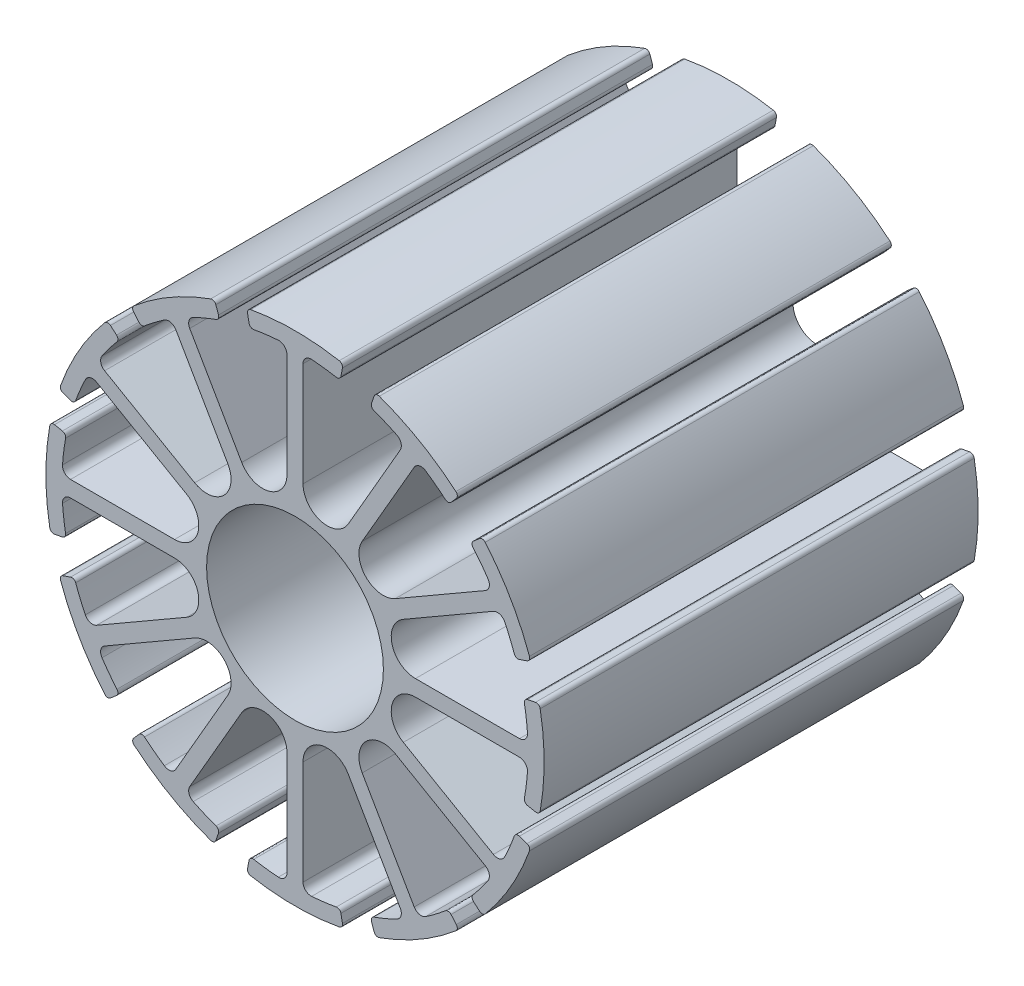
from build123d import *

# Parameters (mm, degrees)
ESBO_O1_R                = 5.5
RESSALTO_EXTRUS_O1_DEPTH = 13.5


with BuildPart() as part:
    # Esboço1 → Ressalto-extrusão1 (new, symmetric)
    with BuildSketch(Plane.XY):
        with BuildLine():
            ThreePointArc((-2.751223029, 15.253884947), (-2.913101633, 15.149133652), (-2.952292747, 14.960343895))
            Line((-2.952292747, 14.960343895), (-2.857263318, 14.469414654))
            ThreePointArc((-2.857263318, 14.469414654), (-2.753143031, 14.310703103), (-2.567551595, 14.270875852))
            ThreePointArc((-2.567551595, 14.270875852), (-1.804201607, 14.387322357), (-1.035735014, 14.462966838))
            ThreePointArc((-1.035735014, 14.462966838), (-0.659328156, 14.330206507), (-0.500020728, 13.96424398))
            Line((-0.500020728, 13.96424398), (-0.500020728, 7.493528993))
            ThreePointArc((-0.500020728, 7.493528993), (-1.617637506, 6.03702245), (-3.313775299, 6.739585728))
            Line((-3.313775299, 6.739585728), (-6.549132327, 12.34338848))
            ThreePointArc((-6.549132327, 12.34338848), (-6.594149336, 12.739974959), (-6.334551729, 13.043152214))
            ThreePointArc((-6.334551729, 13.043152214), (-5.631215734, 13.361876664), (-4.91190973, 13.642706983))
            ThreePointArc((-4.91190973, 13.642706983), (-4.771096457, 13.769994112), (-4.76028142, 13.959502491))
            Line((-4.76028142, 13.959502491), (-4.923448139, 14.432174399))
            ThreePointArc((-4.923448139, 14.432174399), (-5.051783519, 14.576075568), (-5.24435015, 14.585853548))
            ThreePointArc((-5.24435015, 14.585853548), (-7.750020728, 13.423397695), (-10.009572317, 11.834651247))
            ThreePointArc((-10.009572317, 11.834651247), (-10.097387653, 11.662994663), (-10.036933275, 11.47990238))
            Line((-10.036933275, 11.47990238), (-9.709170755, 11.102259901))
            ThreePointArc((-9.709170755, 11.102259901), (-9.539644165, 11.016871809), (-9.359003642, 11.075176116))
            ThreePointArc((-9.359003642, 11.075176116), (-8.756148377, 11.557695254), (-8.128461142, 12.007437319))
            ThreePointArc((-8.128461142, 12.007437319), (-7.736103017, 12.080667042), (-7.415157391, 11.843387892))
            Line((-7.415157391, 11.843387892), (-4.179795149, 6.239576108))
            ThreePointArc((-4.179795149, 6.239576108), (-4.4194264, 4.419396052), (-6.239606455, 4.179764801))
            Line((-6.239606455, 4.179764801), (-11.843415091, 7.415125225))
            ThreePointArc((-11.843415091, 7.415125225), (-12.080694167, 7.736070529), (-12.007464889, 8.128428427))
            ThreePointArc((-12.007464889, 8.128428427), (-11.557717851, 8.756123921), (-11.075192908, 9.35898685))
            ThreePointArc((-11.075192908, 9.35898685), (-11.016888601, 9.539627373), (-11.102276693, 9.709153963))
            Line((-11.102276693, 9.709153963), (-11.479919172, 10.036916483))
            ThreePointArc((-11.479919172, 10.036916483), (-11.663011455, 10.097370861), (-11.834668039, 10.009555525))
            ThreePointArc((-11.834668039, 10.009555525), (-13.423414487, 7.750003936), (-14.58587034, 5.244333358))
            ThreePointArc((-14.58587034, 5.244333358), (-14.57609236, 5.051766727), (-14.432191191, 4.923431348))
            Line((-14.432191191, 4.923431348), (-13.959519283, 4.760264628))
            ThreePointArc((-13.959519283, 4.760264628), (-13.770010904, 4.771079666), (-13.642723775, 4.911892938))
            ThreePointArc((-13.642723775, 4.911892938), (-13.36189719, 5.631190083), (-13.043177406, 6.334517641))
            ThreePointArc((-13.043177406, 6.334517641), (-12.740000178, 6.594115747), (-12.343413383, 6.549098835))
            Line((-12.343413383, 6.549098835), (-6.739596836, 3.313733844))
            ThreePointArc((-6.739596836, 3.313733844), (-6.037033558, 1.61759605), (-7.493540101, 0.499979272))
            Line((-7.493540101, 0.499979272), (-13.964262538, 0.499979272))
            ThreePointArc((-13.964262538, 0.499979272), (-14.330224764, 0.659286377), (-14.46298546, 1.035692677))
            ThreePointArc((-14.46298546, 1.035692677), (-14.387340742, 1.80417211), (-14.270892644, 2.567534803))
            ThreePointArc((-14.270892644, 2.567534803), (-14.310719895, 2.753126239), (-14.469431446, 2.857246526))
            Line((-14.469431446, 2.857246526), (-14.960360687, 2.952275955))
            ThreePointArc((-14.960360687, 2.952275955), (-15.149150444, 2.913084841), (-15.253901739, 2.751206237))
            ThreePointArc((-15.253901739, 2.751206237), (-15.500020728, 3.936e-06), (-15.253901739, -2.751198365))
            ThreePointArc((-15.253901739, -2.751198365), (-15.149150444, -2.913076969), (-14.960360687, -2.952268083))
            Line((-14.960360687, -2.952268083), (-14.469431446, -2.857238654))
            ThreePointArc((-14.469431446, -2.857238654), (-14.310719895, -2.753118367), (-14.270892644, -2.567526931))
            ThreePointArc((-14.270892644, -2.567526931), (-14.387337556, -1.804189649), (-14.462981801, -1.035735894))
            ThreePointArc((-14.462981801, -1.035735894), (-14.330221834, -0.659328479), (-13.964259005, -0.500020728))
            Line((-13.964259005, -0.500020728), (-7.493528993, -0.500020728))
            ThreePointArc((-7.493528993, -0.500020728), (-6.03702245, -1.617637506), (-6.739585728, -3.313775299))
            Line((-6.739585728, -3.313775299), (-12.34339224, -6.549134498))
            ThreePointArc((-12.34339224, -6.549134498), (-12.739978209, -6.594151663), (-13.043155508, -6.334554858))
            ThreePointArc((-13.043155508, -6.334554858), (-13.361887456, -5.631205306), (-13.642723775, -4.911885066))
            ThreePointArc((-13.642723775, -4.911885066), (-13.770010904, -4.771071794), (-13.959519283, -4.760256756))
            Line((-13.959519283, -4.760256756), (-14.432191191, -4.923423476))
            ThreePointArc((-14.432191191, -4.923423476), (-14.57609236, -5.051758855), (-14.58587034, -5.244325486))
            ThreePointArc((-14.58587034, -5.244325486), (-13.423414487, -7.749996064), (-11.834668039, -10.009547653))
            ThreePointArc((-11.834668039, -10.009547653), (-11.663011455, -10.097362989), (-11.479919172, -10.036908611))
            Line((-11.479919172, -10.036908611), (-11.102276693, -9.709146091))
            ThreePointArc((-11.102276693, -9.709146091), (-11.016888601, -9.539619501), (-11.075192908, -9.358978978))
            ThreePointArc((-11.075192908, -9.358978978), (-11.557702717, -8.756136026), (-12.00743679, -8.128462064))
            ThreePointArc((-12.00743679, -8.128462064), (-12.08066723, -7.736103576), (-11.84338796, -7.415157431))
            Line((-11.84338796, -7.415157431), (-6.239576108, -4.179795149))
            ThreePointArc((-6.239576108, -4.179795149), (-4.419396052, -4.4194264), (-4.179764801, -6.239606455))
            Line((-4.179764801, -6.239606455), (-7.415119706, -11.843405531))
            ThreePointArc((-7.415119706, -11.843405531), (-7.73606454, -12.080684499), (-8.128422111, -12.007455869))
            ThreePointArc((-8.128422111, -12.007455869), (-8.756129592, -11.557701613), (-9.359003642, -11.075168244))
            ThreePointArc((-9.359003642, -11.075168244), (-9.539644165, -11.016863937), (-9.709170755, -11.102252029))
            Line((-9.709170755, -11.102252029), (-10.036933275, -11.479894508))
            ThreePointArc((-10.036933275, -11.479894508), (-10.097387653, -11.662986791), (-10.009572317, -11.834643375))
            ThreePointArc((-10.009572317, -11.834643375), (-7.750020728, -13.423389823), (-5.24435015, -14.585845676))
            ThreePointArc((-5.24435015, -14.585845676), (-5.051783519, -14.576067696), (-4.923448139, -14.432166527))
            Line((-4.923448139, -14.432166527), (-4.76028142, -13.959494619))
            ThreePointArc((-4.76028142, -13.959494619), (-4.771096457, -13.76998624), (-4.91190973, -13.642699111))
            ThreePointArc((-4.91190973, -13.642699111), (-5.631194017, -13.361877944), (-6.334509331, -13.043164933))
            ThreePointArc((-6.334509331, -13.043164933), (-6.594108162, -12.739987744), (-6.549091391, -12.343400489))
            Line((-6.549091391, -12.343400489), (-3.313733844, -6.739596836))
            ThreePointArc((-3.313733844, -6.739596836), (-1.61759605, -6.037033558), (-0.499979272, -7.493540101))
            Line((-0.499979272, -7.493540101), (-0.499979272, -13.964239076))
            ThreePointArc((-0.499979272, -13.964239076), (-0.659286157, -14.330201098), (-1.035692077, -14.462962041))
            ThreePointArc((-1.035692077, -14.462962041), (-1.804180251, -14.387317163), (-2.567551595, -14.27086798))
            ThreePointArc((-2.567551595, -14.27086798), (-2.753143031, -14.310695231), (-2.857263318, -14.469406782))
            Line((-2.857263318, -14.469406782), (-2.952292747, -14.960336023))
            ThreePointArc((-2.952292747, -14.960336023), (-2.913101633, -15.14912578), (-2.751223029, -15.253877075))
            ThreePointArc((-2.751223029, -15.253877075), (-2.0728e-05, -15.499996064), (2.751181573, -15.253877075))
            ThreePointArc((2.751181573, -15.253877075), (2.913060177, -15.14912578), (2.952251292, -14.960336023))
            Line((2.952251292, -14.960336023), (2.857221862, -14.469406782))
            ThreePointArc((2.857221862, -14.469406782), (2.753101575, -14.310695231), (2.567510139, -14.27086798))
            ThreePointArc((2.567510139, -14.27086798), (1.804181507, -14.387311807), (1.035736494, -14.462955892))
            ThreePointArc((1.035736494, -14.462955892), (0.659328699, -14.330196172), (0.500020728, -13.964233139))
            Line((0.500020728, -13.964233139), (0.500020728, -7.493528993))
            ThreePointArc((0.500020728, -7.493528993), (1.617637506, -6.03702245), (3.313775299, -6.739585728))
            Line((3.313775299, -6.739585728), (6.549119699, -12.343366608))
            ThreePointArc((6.549119699, -12.343366608), (6.594136876, -12.739952539), (6.33454013, -13.043129841))
            ThreePointArc((6.33454013, -13.043129841), (5.631189572, -13.361862347), (4.911868274, -13.642699111))
            ThreePointArc((4.911868274, -13.642699111), (4.771055002, -13.76998624), (4.760239964, -13.959494619))
            Line((4.760239964, -13.959494619), (4.923406684, -14.432166527))
            ThreePointArc((4.923406684, -14.432166527), (5.051742063, -14.576067696), (5.244308694, -14.585845676))
            ThreePointArc((5.244308694, -14.585845676), (7.749979272, -13.423389823), (10.009530861, -11.834643375))
            ThreePointArc((10.009530861, -11.834643375), (10.097346197, -11.662986791), (10.036891819, -11.479894508))
            Line((10.036891819, -11.479894508), (9.709129299, -11.102252029))
            ThreePointArc((9.709129299, -11.102252029), (9.539602709, -11.016863937), (9.358962186, -11.075168244))
            ThreePointArc((9.358962186, -11.075168244), (8.756120149, -11.55767736), (8.128447172, -12.00741084))
            ThreePointArc((8.128447172, -12.00741084), (7.736088658, -12.080641333), (7.415142474, -11.843362054))
            Line((7.415142474, -11.843362054), (4.179795149, -6.239576108))
            ThreePointArc((4.179795149, -6.239576108), (4.4194264, -4.419396052), (6.239606455, -4.179764801))
            Line((6.239606455, -4.179764801), (11.843381453, -7.415105805))
            ThreePointArc((11.843381453, -7.415105805), (12.080660473, -7.736050865), (12.007431531, -8.128408594))
            ThreePointArc((12.007431531, -8.128408594), (11.557680757, -8.756110293), (11.075151452, -9.358978978))
            ThreePointArc((11.075151452, -9.358978978), (11.016847145, -9.539619501), (11.102235237, -9.709146091))
            Line((11.102235237, -9.709146091), (11.479877716, -10.036908611))
            ThreePointArc((11.479877716, -10.036908611), (11.662969999, -10.097362989), (11.834626583, -10.009547653))
            ThreePointArc((11.834626583, -10.009547653), (13.423373031, -7.749996064), (14.585828885, -5.244325486))
            ThreePointArc((14.585828885, -5.244325486), (14.576050904, -5.051758855), (14.432149735, -4.923423476))
            Line((14.432149735, -4.923423476), (13.959477827, -4.760256756))
            ThreePointArc((13.959477827, -4.760256756), (13.769969448, -4.771071794), (13.642682319, -4.911885066))
            ThreePointArc((13.642682319, -4.911885066), (13.361858539, -5.631175556), (13.04314226, -6.334496776))
            ThreePointArc((13.04314226, -6.334496776), (12.739965053, -6.594095257), (12.343378019, -6.549078418))
            Line((12.343378019, -6.549078418), (6.739596836, -3.313733844))
            ThreePointArc((6.739596836, -3.313733844), (6.037033558, -1.61759605), (7.493540101, -0.499979272))
            Line((7.493540101, -0.499979272), (13.964220518, -0.499979272))
            ThreePointArc((13.964220518, -0.499979272), (14.330182841, -0.65928648), (14.46294342, -1.035692958))
            ThreePointArc((14.46294342, -1.035692958), (14.387298778, -1.804168293), (14.270851188, -2.567526931))
            ThreePointArc((14.270851188, -2.567526931), (14.310678439, -2.753118367), (14.469389991, -2.857238654))
            Line((14.469389991, -2.857238654), (14.960319231, -2.952268083))
            ThreePointArc((14.960319231, -2.952268083), (15.149108988, -2.913076969), (15.253860283, -2.751198365))
            ThreePointArc((15.253860283, -2.751198365), (15.499979272, 3.936e-06), (15.253860283, 2.751206237))
            ThreePointArc((15.253860283, 2.751206237), (15.149108988, 2.913084841), (14.960319231, 2.952275955))
            Line((14.960319231, 2.952275955), (14.469389991, 2.857246526))
            ThreePointArc((14.469389991, 2.857246526), (14.310678439, 2.753126239), (14.270851188, 2.567534803))
            ThreePointArc((14.270851188, 2.567534803), (14.387296609, 1.804193466), (14.462940929, 1.035735613))
            ThreePointArc((14.462940929, 1.035735613), (14.330180846, 0.659328376), (13.964218113, 0.500020728))
            Line((13.964218113, 0.500020728), (7.493528993, 0.500020728))
            ThreePointArc((7.493528993, 0.500020728), (6.03702245, 1.617637506), (6.739585728, 3.313775299))
            Line((6.739585728, 3.313775299), (12.343362848, 6.549117528))
            ThreePointArc((12.343362848, 6.549117528), (12.739949289, 6.594134549), (13.043126547, 6.334537001))
            ThreePointArc((13.043126547, 6.334537001), (13.361851554, 5.6312), (13.642682319, 4.911892938))
            ThreePointArc((13.642682319, 4.911892938), (13.769969448, 4.771079666), (13.959477827, 4.760264628))
            Line((13.959477827, 4.760264628), (14.432149735, 4.923431348))
            ThreePointArc((14.432149735, 4.923431348), (14.576050904, 5.051766727), (14.585828885, 5.244333358))
            ThreePointArc((14.585828885, 5.244333358), (13.423373031, 7.750003936), (11.834626583, 10.009555525))
            ThreePointArc((11.834626583, 10.009555525), (11.662969999, 10.097370861), (11.479877716, 10.036916483))
            Line((11.479877716, 10.036916483), (11.102235237, 9.709153963))
            ThreePointArc((11.102235237, 9.709153963), (11.016847145, 9.539627373), (11.075151452, 9.35898685))
            ThreePointArc((11.075151452, 9.35898685), (11.557669897, 8.756132499), (12.007411368, 8.12844625))
            ThreePointArc((12.007411368, 8.12844625), (12.080641145, 7.736088099), (11.843361986, 7.415142434))
            Line((11.843361986, 7.415142434), (6.239576108, 4.179795149))
            ThreePointArc((6.239576108, 4.179795149), (4.419396052, 4.4194264), (4.179764801, 6.239606456))
            Line((4.179764801, 6.239606456), (7.415111324, 11.843391013))
            ThreePointArc((7.415111324, 11.843391013), (7.736056853, 12.080670141), (8.12841491, 12.007440552))
            ThreePointArc((8.12841491, 12.007440552), (8.756104622, 11.557696995), (9.358962186, 11.075176116))
            ThreePointArc((9.358962186, 11.075176116), (9.539602709, 11.016871809), (9.709129299, 11.102259901))
            Line((9.709129299, 11.102259901), (10.036891819, 11.47990238))
            ThreePointArc((10.036891819, 11.47990238), (10.097346197, 11.662994663), (10.009530861, 11.834651247))
            ThreePointArc((10.009530861, 11.834651247), (7.749979272, 13.423397695), (5.244308694, 14.585853548))
            ThreePointArc((5.244308694, 14.585853548), (5.051742063, 14.576075568), (4.923406684, 14.432174399))
            Line((4.923406684, 14.432174399), (4.760239964, 13.959502491))
            ThreePointArc((4.760239964, 13.959502491), (4.771055002, 13.769994112), (4.911868274, 13.642706983))
            ThreePointArc((4.911868274, 13.642706983), (5.631171621, 13.361877784), (6.334505085, 13.043154733))
            ThreePointArc((6.334505085, 13.043154733), (6.594102842, 12.739977486), (6.549085862, 12.343390913))
            Line((6.549085862, 12.343390913), (3.313733844, 6.739596836))
            ThreePointArc((3.313733844, 6.739596836), (1.61759605, 6.037033558), (0.499979272, 7.493540101))
            Line((0.499979272, 7.493540101), (0.499979272, 13.96424398))
            ThreePointArc((0.499979272, 13.96424398), (0.6592867, 14.330206507), (1.035693558, 14.462966838))
            ThreePointArc((1.035693558, 14.462966838), (1.804160151, 14.387322357), (2.567510139, 14.270875852))
            ThreePointArc((2.567510139, 14.270875852), (2.753101575, 14.310703103), (2.857221862, 14.469414654))
            Line((2.857221862, 14.469414654), (2.952251292, 14.960343895))
            ThreePointArc((2.952251292, 14.960343895), (2.913060177, 15.149133652), (2.751181573, 15.253884947))
            ThreePointArc((2.751181573, 15.253884947), (-2.0728e-05, 15.500003936), (-2.751223029, 15.253884947))
        make_face()
        with Locations((-2.0728e-05, 3.936e-06)):
            Circle(ESBO_O1_R, mode=Mode.SUBTRACT)
    extrude(amount=RESSALTO_EXTRUS_O1_DEPTH, both=True)


solid = part.part
